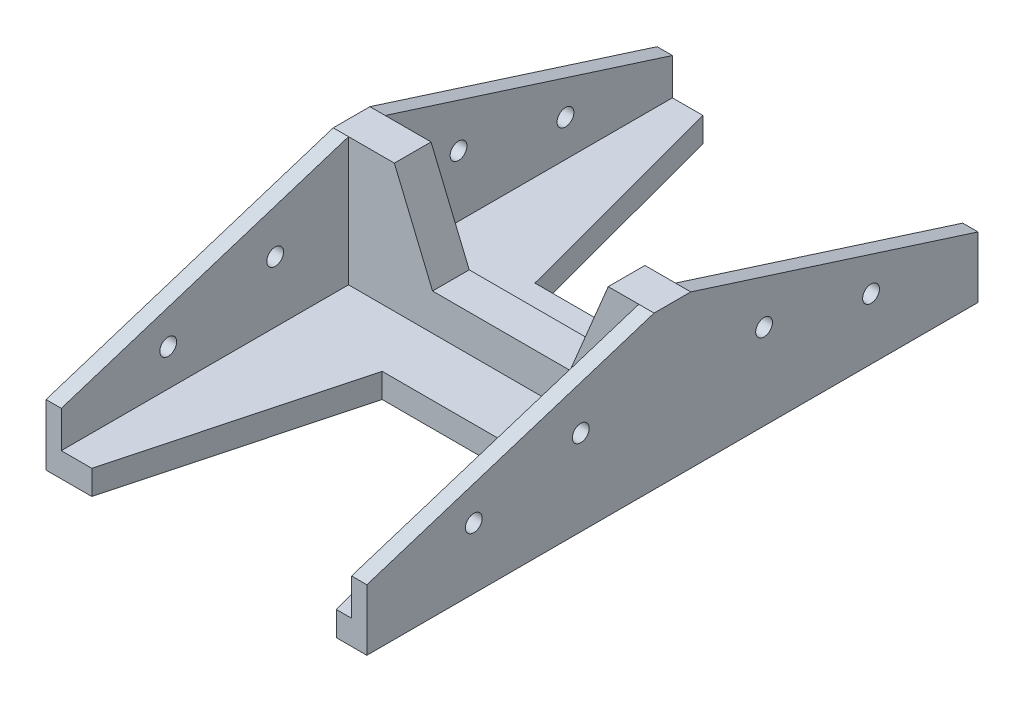
from build123d import *

# Parameters (mm, degrees)
EXTRUDE_1_DEPTH     = 5
EXTRUDE_2_DEPTH     = 100
CUT_EXTRUDE_1_DEPTH = 100
CUT_EXTRUDE_2_DEPTH = 100
EXTRUDE_3_DEPTH     = 5
EXTRUDE_4_DEPTH     = 5
SKETCH_9_R          = 2.75
CUT_EXTRUDE_3_DEPTH = 149.07092895


with BuildPart() as part:
    # 草图1 → 凸台-拉伸1 (new body)
    with BuildSketch(Plane(origin=(0, 0, 0), x_dir=(0, 0, -1), z_dir=(1, 0, 0))):
        Polygon((6, 0), (100, 0), (100, -20), (-100, -20), (-100, 0), (-6, 0), (-6, 30), (6, 30), align=None)
    extrude(amount=EXTRUDE_1_DEPTH)

    # 草图2 → 凸台-拉伸2 (add)
    with BuildSketch(Plane(origin=(5, 0, 0), x_dir=(0, 0, -1), z_dir=(1, 0, 0))):
        Polygon((-6, -12), (-6, 30), (6, 30), (6, -12), (100, -12), (100, -20), (-100, -20), (-100, -12), align=None)
    extrude(amount=EXTRUDE_2_DEPTH)

    # 草图3 → 切除-拉伸1 (cut)
    with BuildSketch(Plane(origin=(0, -12, 0), x_dir=(1, 0, 0), z_dir=(0, 1, 0))):
        Polygon((15, 100), (35, 25), (75, 25), (95, 100), align=None)
        Polygon((15, -100), (35, -25), (75, -25), (95, -100), align=None)
    extrude(amount=-CUT_EXTRUDE_1_DEPTH, mode=Mode.SUBTRACT)

    # 草图5 → 切除-拉伸2 (cut)
    with BuildSketch(Plane.XY.offset(6)):
        Polygon((20, 30), (32.5, 0), (77.5, 0), (90, 30), align=None)
    extrude(amount=-CUT_EXTRUDE_2_DEPTH, mode=Mode.SUBTRACT)

    # 草图6 → 凸台-拉伸3 (add)
    with BuildSketch(Plane(origin=(5, 0, 0), x_dir=(0, 0, -1), z_dir=(1, 0, 0))):
        Polygon((-100, 0), (-6, 30), (-6, 0), align=None)
        Polygon((6, 0), (100, 0), (6, 30), align=None)
    extrude(amount=-EXTRUDE_3_DEPTH)

    # 草图7 → 凸台-拉伸4 (add)
    with BuildSketch(Plane(origin=(105, 0, 0), x_dir=(0, 0, -1), z_dir=(1, 0, 0))):
        Polygon((6, 30), (6, -12), (100, -12), (100, 0), align=None)
        Polygon((-100, -12), (-6, -12), (-6, 30), (-100, 0), align=None)
    extrude(amount=-EXTRUDE_4_DEPTH)

    # 草图9 → 切除-拉伸3 (cut, through all)
    with BuildSketch(Plane(origin=(105, 0, 0), x_dir=(0, 0, -1), z_dir=(1, 0, 0))):
        with Locations((30, 8)):
            Circle(SKETCH_9_R)
        with Locations((65, 0)):
            Circle(SKETCH_9_R)
        with Locations((-65, 0)):
            Circle(SKETCH_9_R)
        with Locations((-30, 8)):
            Circle(SKETCH_9_R)
    extrude(amount=-CUT_EXTRUDE_3_DEPTH, mode=Mode.SUBTRACT)


solid = part.part
